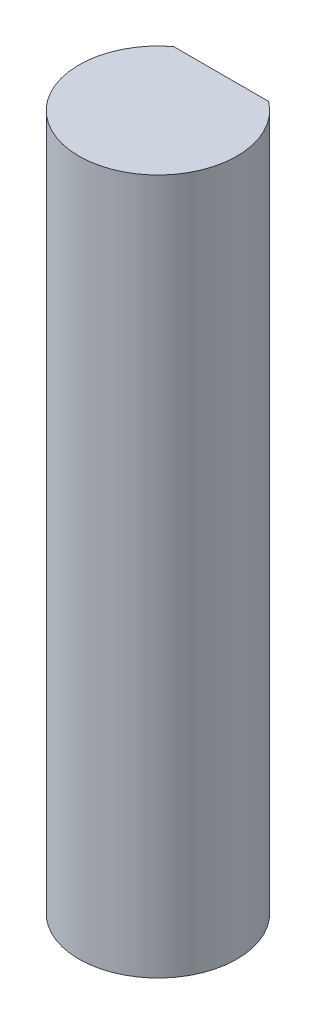
from build123d import *

# Parameters (mm, degrees)
BOSS_EXTRUDE1_DEPTH = 22
BOSS_EXTRUDE2_DEPTH = 4


with BuildPart() as part:
    # Sketch2 → Boss-Extrude1 (new body)
    with BuildSketch(Plane(origin=(0, 0, 0), x_dir=(1, 0, 0), z_dir=(0, 1, 0))):
        with BuildLine():
            ThreePointArc((-1.5, 2), (0, -2.5), (1.5, 2))
            Line((1.5, 2), (-1.5, 2))
        make_face()
    extrude(amount=BOSS_EXTRUDE1_DEPTH)

    # Sketch2<3> → Boss-Extrude2 (add)
    with BuildSketch(Plane(origin=(0, 0, 0), x_dir=(1, 0, 0), z_dir=(0, 1, 0))):
        with BuildLine():
            ThreePointArc((1.5, 2), (0, 2.5), (-1.5, 2))
            Line((-1.5, 2), (1.5, 2))
        make_face()
    extrude(amount=BOSS_EXTRUDE2_DEPTH)


solid = part.part
